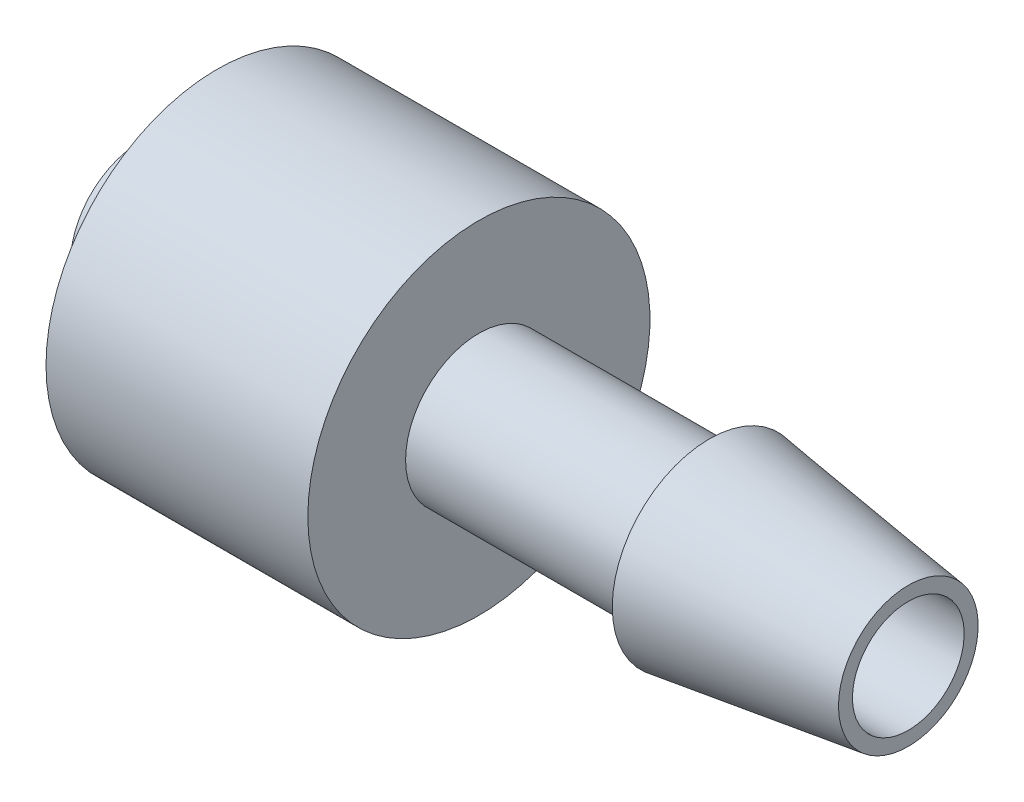
from build123d import *


with BuildPart() as part:
    # Sketch1 → Revolve2 (revolve)
    with BuildSketch(Plane.XY):
        Polygon((0.438638081, 0), (0.438638081, 0.4), (-5.261361919, 1.18), (-5.261361919, 0.5), (-11.861361919, 0.5), (-11.861361919, 3.3), (-19.361361919, 3.3), (-19.361361919, 2.4), (-12.961361919, 2.4), (-12.961361919, 0.4), (-21.561361919, 0.4), (-21.561361919, -0.1), (-11.861361919, -0.1), (-11.861361919, 0), align=None)
    revolve(axis=Axis((-25.581495944, -1.6, 0), (1, 0, 0)))


solid = part.part
